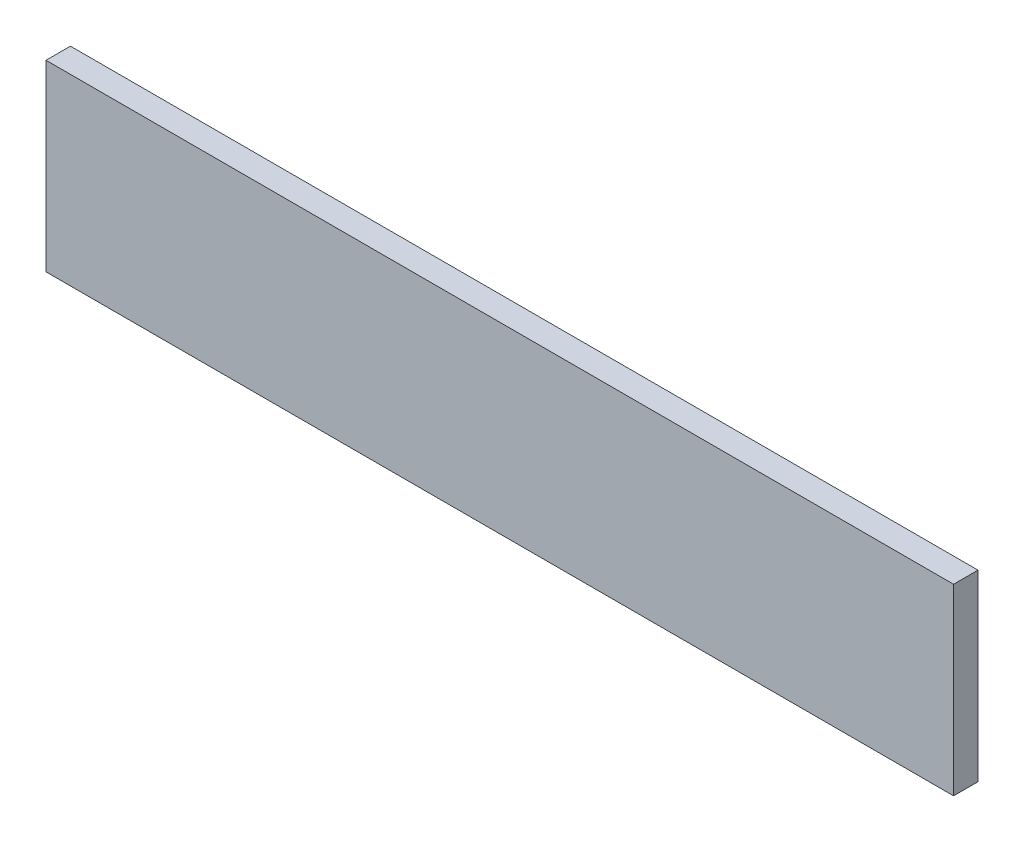
from build123d import *

# Parameters (mm, degrees)
SKETCH1_W           = 148.57
SKETCH1_H           = 30
BOSS_EXTRUDE1_DEPTH = 4


with BuildPart() as part:
    # Sketch1 → Boss-Extrude1 (new body)
    with BuildSketch(Plane.XY):
        with Locations((74.285, 15)):
            Rectangle(SKETCH1_W, SKETCH1_H)
    extrude(amount=BOSS_EXTRUDE1_DEPTH)


solid = part.part
